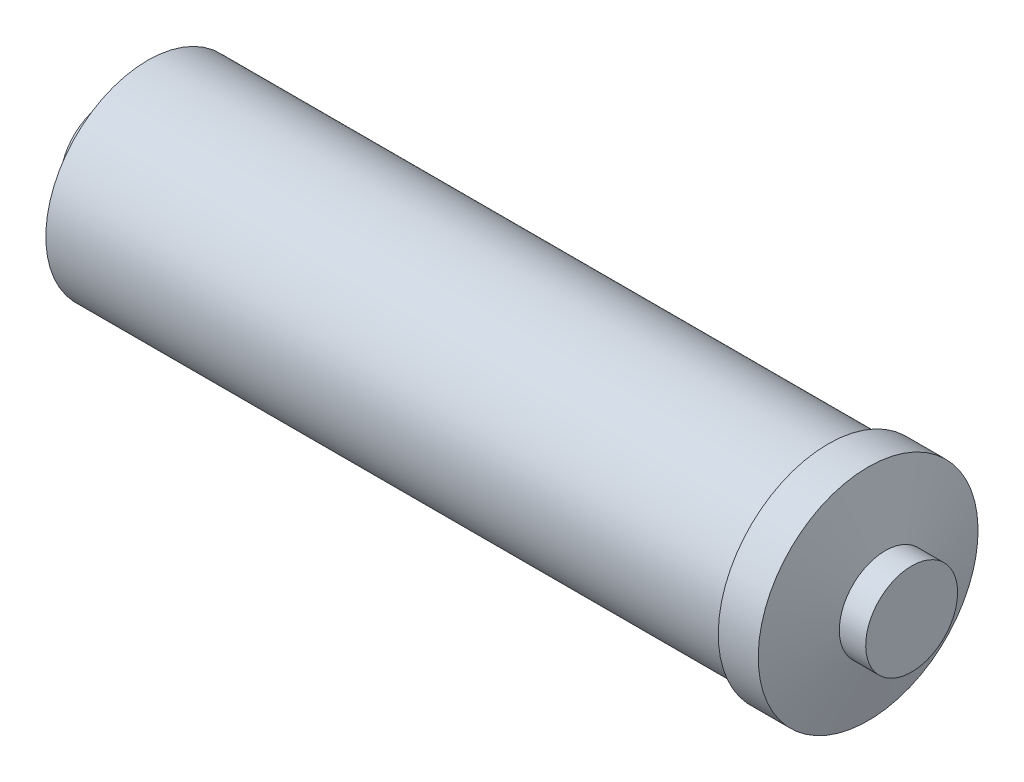
from build123d import *


with BuildPart() as part:
    # Sketch1 → Revolve1 (revolve)
    with BuildSketch(Plane.XY):
        Polygon((0, 0), (-255.905, 0), (-255.905, 14.605), (-247.523, 14.605), (-242.758863359, 32.385), (-27.207318539, 32.385), (-26.52672759, 34.925), (-13.82672759, 34.925), (-8.382, 14.605), (0, 14.605), align=None)
    revolve(axis=Axis((0, 0, 0), (-1, 0, 0)))


solid = part.part
